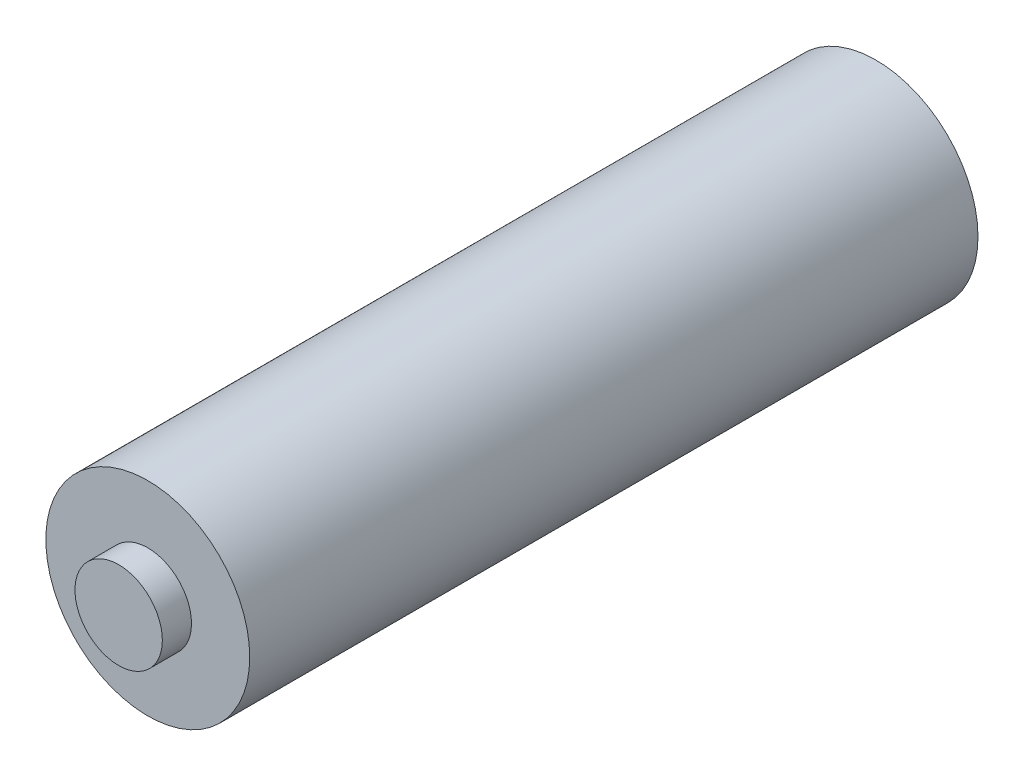
from build123d import *

# Parameters (mm, degrees)
SKETCH1_R           = 17.5
BOSS_EXTRUDE1_DEPTH = 125
SKETCH2_R           = 7.5
BOSS_EXTRUDE2_DEPTH = 5
BOSS_EXTRUDE3_START = 5
SKETCH3_R           = 7.5
BOSS_EXTRUDE3_DEPTH = 5


with BuildPart() as part:
    # Sketch1 → Boss-Extrude1 (new body)
    with BuildSketch(Plane.XY):
        Circle(SKETCH1_R)
    extrude(amount=BOSS_EXTRUDE1_DEPTH)

    # Sketch2 → Boss-Extrude2 (add)
    with BuildSketch(Plane.XY.offset(125)):
        Circle(SKETCH2_R)
    extrude(amount=BOSS_EXTRUDE2_DEPTH)

    # Sketch3 → Boss-Extrude3 (add)
    with BuildSketch(Plane(origin=(0, 0, 0), x_dir=(-1, 0, 0), z_dir=(0, 0, -1)).offset(BOSS_EXTRUDE3_START)):
        with Locations(Location((0, 0, 0), (0, 0, 180))):
            Circle(SKETCH3_R)
    extrude(amount=-BOSS_EXTRUDE3_DEPTH)


solid = part.part
